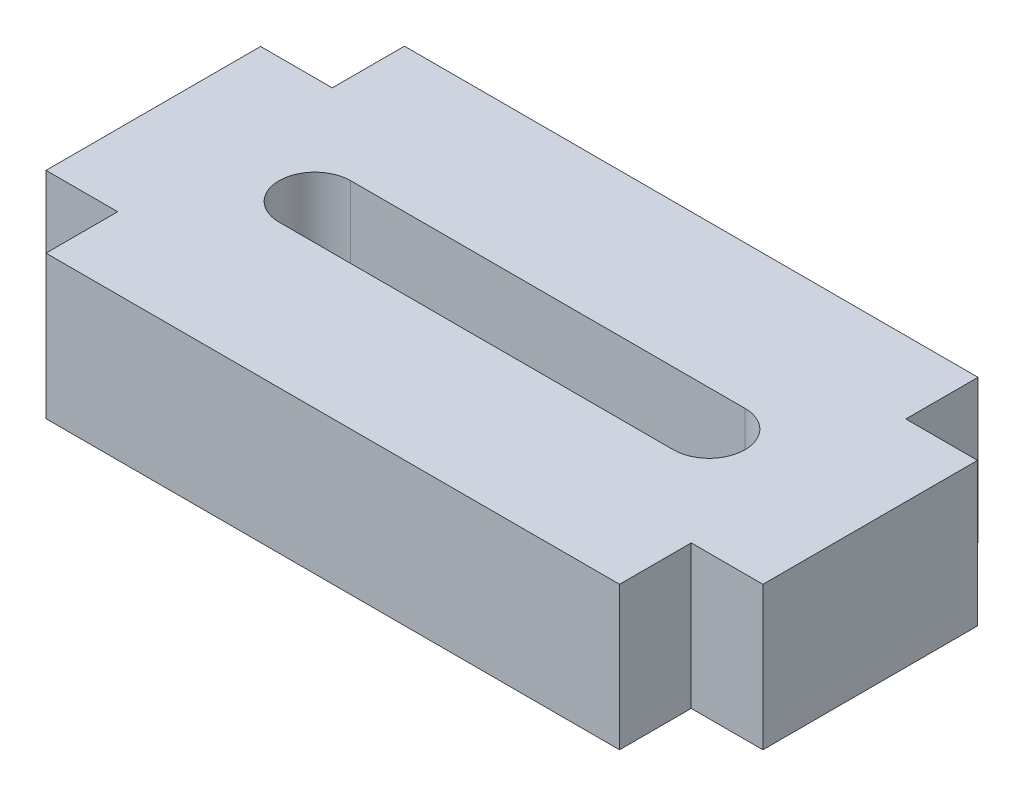
from build123d import *

# Parameters (mm, degrees)
SKETCH2_W           = 50
SKETCH2_H           = 25
BOSS_EXTRUDE1_DEPTH = 10
SKETCH3_W           = 5
SKETCH3_H           = 5.034252603
SKETCH3_H_2         = 5
CUT_EXTRUDE1_DEPTH  = 30.685855218
CUT_EXTRUDE2_DEPTH  = 30.685855218


with BuildPart() as part:
    # Sketch2 → Boss-Extrude1 (new body)
    with BuildSketch(Plane(origin=(0, 0, 0), x_dir=(1, 0, 0), z_dir=(0, 1, 0))):
        Rectangle(SKETCH2_W, SKETCH2_H)
    extrude(amount=BOSS_EXTRUDE1_DEPTH)

    # Sketch3 → Cut-Extrude1 (cut, through all)
    with BuildSketch(Plane(origin=(0, 10, 0), x_dir=(1, 0, 0), z_dir=(0, 1, 0))):
        with Locations((22.5, 9.982873699)):
            Rectangle(SKETCH3_W, SKETCH3_H)
        with Locations((22.5, -10)):
            Rectangle(SKETCH3_W, SKETCH3_H_2)
    cut_extrude1 = extrude(amount=-CUT_EXTRUDE1_DEPTH, mode=Mode.SUBTRACT)

    # Mirror1: Cut-Extrude1 across plane
    add(cut_extrude1.mirror(Plane(origin=(0, 0, 0), x_dir=(0, 0, 1), z_dir=(1, 0, 0))), mode=Mode.SUBTRACT)

    # Sketch4 → Cut-Extrude2 (cut, through all)
    with BuildSketch(Plane(origin=(0, 10, 0), x_dir=(1, 0, 0), z_dir=(0, 1, 0))):
        with BuildLine():
            Line((-13.75, 2.5), (13.75, 2.5))
            ThreePointArc((13.75, 2.5), (16.25, 0), (13.75, -2.5))
            Line((13.75, -2.5), (-13.75, -2.5))
            ThreePointArc((-13.75, -2.5), (-16.25, 0), (-13.75, 2.5))
        make_face()
    extrude(amount=-CUT_EXTRUDE2_DEPTH, mode=Mode.SUBTRACT)


solid = part.part
